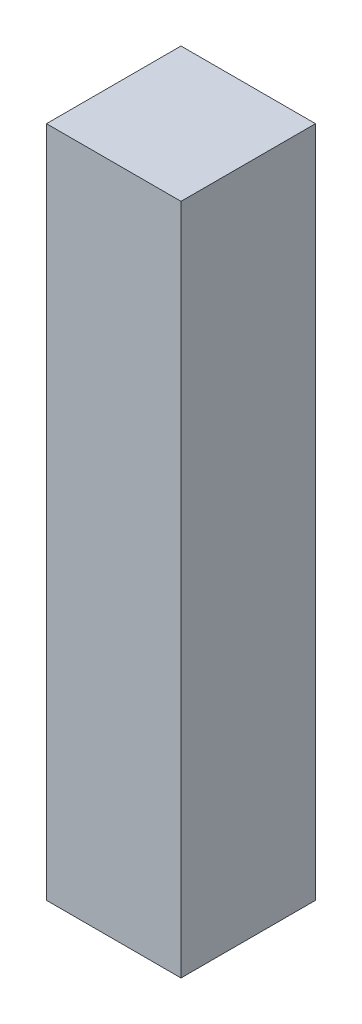
from build123d import *

# Parameters (mm, degrees)
SKETCH1_W           = 20
SKETCH1_H           = 20
BOSS_EXTRUDE1_DEPTH = 100


with BuildPart() as part:
    # Sketch1 → Boss-Extrude1 (new body)
    with BuildSketch(Plane(origin=(0, 0, 0), x_dir=(1, 0, 0), z_dir=(0, 1, 0))):
        with Locations((10, -10)):
            Rectangle(SKETCH1_W, SKETCH1_H)
    extrude(amount=BOSS_EXTRUDE1_DEPTH)


solid = part.part
